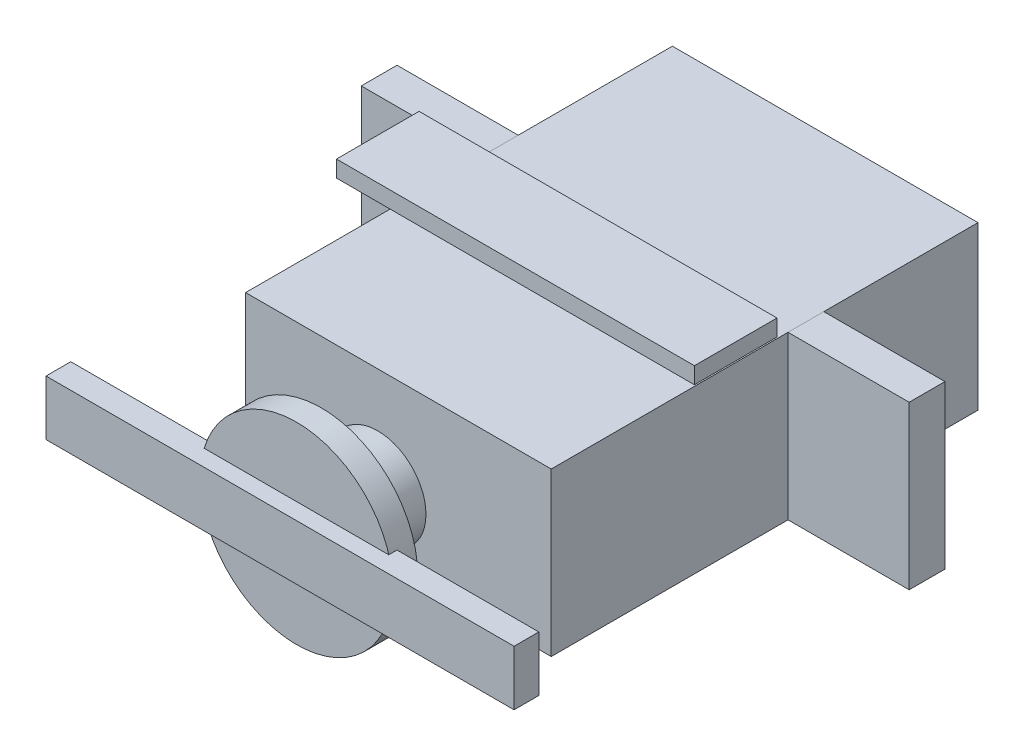
from build123d import *

# Parameters (mm, degrees)
SG90_START                                 = -15.5
SKETCH_1_W                                 = 22.2
SKETCH_1_H                                 = 11.8
SG90_BODY_APPROX_22_2_X_11_8_X_31_MM_DEPTH = 31
SG90_START_2                               = -4.3
SKETCH_2_W                                 = 8.8
SKETCH_2_H                                 = 11.8
SG90_MOUNTING_EAR_LEFT_DEPTH               = 2.6
SKETCH_3_W                                 = 8.8
SKETCH_3_H                                 = 11.8
SG90_MOUNTING_EAR_RIGHT_DEPTH              = 2.6
SERVO_START                                = 17
SKETCH_4_R                                 = 3.5
SERVO_SPLINE_HUB_DEPTH                     = 3
SERVO_START_2                              = 21.1
SKETCH_5_R                                 = 7
SERVO_HORN_CENTER_DEPTH                    = 1.8
SERVO_START_3                              = 22.3
SKETCH_6_W                                 = 34
SKETCH_6_H                                 = 4
SERVO_HORN_ARM_DEPTH                       = 1.8
SERVO_START_4                              = 1
SKETCH_7_W                                 = 26
SKETCH_7_H                                 = 1.2
SERVO_LABEL_PLATE_SG90_DEPTH               = 6


with BuildPart() as part:
    # 草图1 → SG90 body - approx 22.2 x 11.8 x 31 mm (new body)
    with BuildSketch(Plane.XY.offset(SG90_START)):
        Rectangle(SKETCH_1_W, SKETCH_1_H)
    extrude(amount=SG90_BODY_APPROX_22_2_X_11_8_X_31_MM_DEPTH)


with BuildPart() as body_2:
    # 草图2 → SG90 mounting ear left (new body)
    with BuildSketch(Plane.XY.offset(SG90_START_2)):
        with Locations((-15.5, 0)):
            Rectangle(SKETCH_2_W, SKETCH_2_H)
    extrude(amount=SG90_MOUNTING_EAR_LEFT_DEPTH)


with BuildPart() as body_3:
    # 草图3 → SG90 mounting ear right (new body)
    with BuildSketch(Plane.XY.offset(SG90_START_2)):
        with Locations((15.5, 0)):
            Rectangle(SKETCH_3_W, SKETCH_3_H)
    extrude(amount=SG90_MOUNTING_EAR_RIGHT_DEPTH)


with BuildPart() as body_4:
    # 草图4 → servo spline hub (new body)
    with BuildSketch(Plane.XY.offset(SERVO_START)):
        Circle(SKETCH_4_R)
    extrude(amount=SERVO_SPLINE_HUB_DEPTH)


with BuildPart() as body_5:
    # 草图5 → servo horn center (new body)
    with BuildSketch(Plane.XY.offset(SERVO_START_2)):
        Circle(SKETCH_5_R)
    extrude(amount=SERVO_HORN_CENTER_DEPTH)


with BuildPart() as body_6:
    # 草图6 → servo horn arm (new body)
    with BuildSketch(Plane.XY.offset(SERVO_START_3)):
        Rectangle(SKETCH_6_W, SKETCH_6_H)
    extrude(amount=SERVO_HORN_ARM_DEPTH)


with BuildPart() as body_7:
    # 草图7 → servo label plate - SG90 (new body)
    with BuildSketch(Plane.XY.offset(SERVO_START_4)):
        with Locations((0, 8.5)):
            Rectangle(SKETCH_7_W, SKETCH_7_H)
    extrude(amount=SERVO_LABEL_PLATE_SG90_DEPTH)


solid = Compound([part.part, body_2.part, body_3.part, body_4.part, body_5.part, body_6.part, body_7.part])
